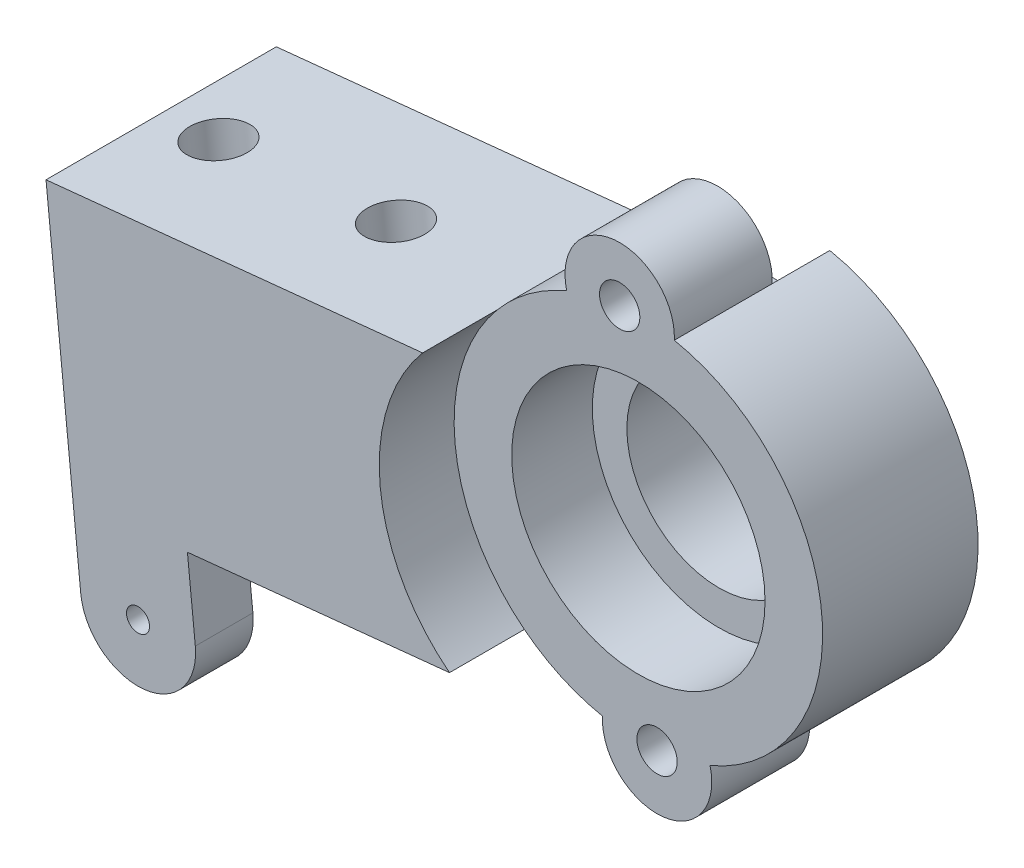
from build123d import *

# Parameters (mm, degrees)
SKETCH1_R                = 16
SKETCH1_R_2              = 11
BOSS_EXTRUDE1_DEPTH      = 7
BOSS_EXTRUDE2_DEPTH      = 10
BOSS_EXTRUDE2_DEPTH_BACK = 10
SKETCH3_W                = 13
SKETCH3_H                = 13
CUT_EXTRUDE1_DEPTH       = 26
BOSS_EXTRUDE5_START      = 6.5
SKETCH8_R                = 16
SKETCH8_R_2              = 8
BOSS_EXTRUDE5_DEPTH      = 6.5
SKETCH9_R                = 1
BOSS_EXTRUDE6_DEPTH      = 20
CUT_EXTRUDE3_DEPTH       = 5
CUT_EXTRUDE3_DEPTH_BACK  = 5
BOSS_EXTRUDE7_START      = -8.5
BOSS_EXTRUDE7_DEPTH      = 8.5
CUT_EXTRUDE4_START       = -13.5
SKETCH12_R               = 1.75
CUT_EXTRUDE4_DEPTH       = 13.5
SKETCH13_R               = 4.75
CUT_EXTRUDE5_DEPTH       = 5
CUT_EXTRUDE6_REACH       = 59.783
SKETCH14_R               = 2.5


with BuildPart() as part:
    # Sketch1 → Boss-Extrude1 (new body)
    with BuildSketch(Plane.XY):
        Circle(SKETCH1_R)
        Circle(SKETCH1_R_2, mode=Mode.SUBTRACT)
    extrude(amount=BOSS_EXTRUDE1_DEPTH)

    # Sketch2 → Boss-Extrude2 (add, two sides: drawn at the far end of the back side and taken through both)
    with BuildSketch(Plane.XY.offset(3.5).offset(-BOSS_EXTRUDE2_DEPTH_BACK)):
        with BuildLine():
            Line((-12.233132214, 10.312636725), (-44.939361172, 6.978812037))
            Line((-44.939361172, 6.978812037), (-42.607001327, -15.902623617))
            Line((-42.607001327, -15.902623617), (-9.900772369, -12.568798928))
            ThreePointArc((-9.900772369, -12.568798928), (-15.917520454, -1.622511196), (-12.233132214, 10.312636725))
        make_face()
    extrude(amount=BOSS_EXTRUDE2_DEPTH + BOSS_EXTRUDE2_DEPTH_BACK)

    # Sketch3 → Cut-Extrude1 (cut)
    with BuildSketch(Plane(origin=(-43.77318125, -4.46190579, 0), x_dir=(0, 0, 1), z_dir=(-0.9948450284027645, -0.10140694977319323, 0))):
        with Locations((3.5, 0)):
            Rectangle(SKETCH3_W, SKETCH3_H)
    extrude(amount=-CUT_EXTRUDE1_DEPTH, mode=Mode.SUBTRACT)

    # Sketch8 → Boss-Extrude5 (add)
    with BuildSketch(Plane(origin=(0, 0, 0), x_dir=(-1, 0, 0), z_dir=(0, 0, -1)).offset(BOSS_EXTRUDE5_START)):
        Circle(SKETCH8_R)
        with Locations(Location((0, 0, 0), (0, 0, 180))):
            Circle(SKETCH8_R_2, mode=Mode.SUBTRACT)
    extrude(amount=-BOSS_EXTRUDE5_DEPTH)

    # Sketch9 → Boss-Extrude6 (add)
    with BuildSketch(Plane(origin=(0, 0, -6.5), x_dir=(-1, 0, 0), z_dir=(0, 0, -1))):
        with BuildLine():
            Line((42.607001327, -15.902623617), (32.658551043, -14.888554119))
            Line((32.658551043, -14.888554119), (31.973720208, -21.607033999))
            ThreePointArc((31.973720208, -21.607033999), (36.440910601, -27.08829389), (41.922170492, -22.621103497))
            Line((41.922170492, -22.621103497), (42.607001327, -15.902623617))
        make_face()
        with Locations((36.94794535, -22.114068748)):
            Circle(SKETCH9_R, mode=Mode.SUBTRACT)
    extrude(amount=-BOSS_EXTRUDE6_DEPTH)

    # Sketch10 → Cut-Extrude3 (cut, two sides: drawn at the far end of the back side and taken through both)
    with BuildSketch(Plane.XY.offset(3.5).offset(-CUT_EXTRUDE3_DEPTH_BACK)):
        with BuildLine():
            Line((-32.658551043, -14.888554119), (-42.607001327, -15.902623617))
            Line((-42.607001327, -15.902623617), (-41.922170492, -22.621103497))
            ThreePointArc((-41.922170492, -22.621103497), (-36.440910601, -27.08829389), (-31.973720208, -21.607033999))
            Line((-31.973720208, -21.607033999), (-32.658551043, -14.888554119))
        make_face()
    extrude(amount=CUT_EXTRUDE3_DEPTH + CUT_EXTRUDE3_DEPTH_BACK, mode=Mode.SUBTRACT)

    # Sketch11 → Boss-Extrude7 (add)
    with BuildSketch(Plane.XY.offset(7).offset(BOSS_EXTRUDE7_START)):
        with BuildLine():
            ThreePointArc((6.224175029, -14.739730161), (2.104194208, -20.643034339), (-3.12215228, -15.692423813))
            ThreePointArc((-3.12215228, -15.692423813), (1.622511196, -15.917520454), (6.224175029, -14.739730161))
        make_face()
    boss_extrude7 = extrude(amount=BOSS_EXTRUDE7_DEPTH)

    # Sketch12 → Cut-Extrude4 (cut)
    with BuildSketch(Plane.XY.offset(7).offset(CUT_EXTRUDE4_START)):
        with Locations((1.622511196, -15.917520454)):
            Circle(SKETCH12_R)
    cut_extrude4 = extrude(amount=CUT_EXTRUDE4_DEPTH, mode=Mode.SUBTRACT)

    # Mirror1: Boss-Extrude7, Cut-Extrude4 across plane
    add(boss_extrude7.mirror(Plane(origin=(0, 0, 0), x_dir=(0, 0, 1), z_dir=(0.10140694977319331, -0.9948450284027645, 0))))
    add(cut_extrude4.mirror(Plane(origin=(0, 0, 0), x_dir=(0, 0, 1), z_dir=(0.10140694977319331, -0.9948450284027645, 0))), mode=Mode.SUBTRACT)

    # Sketch13 → Cut-Extrude5 (cut)
    with BuildSketch(Plane(origin=(0, 0, -6.5), x_dir=(-1, 0, 0), z_dir=(0, 0, -1))):
        with Locations((-1.622511196, -15.917520454)):
            Circle(SKETCH13_R)
        with Locations((1.622511196, 15.917520454)):
            Circle(SKETCH13_R)
    extrude(amount=-CUT_EXTRUDE5_DEPTH, mode=Mode.SUBTRACT)

    # Cut-Extrude6: up to this face of the body (flat: up to its plane)
    cut_extrude6_end = Plane(part.part.faces().sort_by_distance((-28.586246693, 8.645724381, 3.5))[0])
    # Sketch14 → Cut-Extrude6 (cut, up to the picked face)
    with BuildSketch(Plane(origin=(1.166179922, -11.440717827, 0), x_dir=(0.9948450284027645, 0.1014069497731933, 0), z_dir=(0.1014069497731933, -0.9948450284027645, 0)), mode=Mode.PRIVATE) as cut_extrude6_sk1:
        with Locations((-39, 3.5)):
            Circle(SKETCH14_R)
    cut_extrude6_tool1 = split(extrude(cut_extrude6_sk1.sketch, amount=-CUT_EXTRUDE6_REACH, mode=Mode.PRIVATE), bisect_by=cut_extrude6_end, keep=Keep.BOTH, mode=Mode.PRIVATE)
    # Sketch14 → Cut-Extrude6 (cut, up to the picked face)
    with BuildSketch(Plane(origin=(1.166179922, -11.440717827, 0), x_dir=(0.9948450284027645, 0.1014069497731933, 0), z_dir=(0.1014069497731933, -0.9948450284027645, 0)), mode=Mode.PRIVATE) as cut_extrude6_sk2:
        with Locations((-23.5, 3.5)):
            Circle(SKETCH14_R)
    cut_extrude6_tool2 = split(extrude(cut_extrude6_sk2.sketch, amount=-CUT_EXTRUDE6_REACH, mode=Mode.PRIVATE), bisect_by=cut_extrude6_end, keep=Keep.BOTH, mode=Mode.PRIVATE)
    add(cut_extrude6_tool1.solids().sort_by(Axis((-37.632776, -15.395589, 3.5), (-0.1014069497731933, 0.9948450284027645, 0)))[0], mode=Mode.SUBTRACT)
    add(cut_extrude6_tool2.solids().sort_by(Axis((-22.212678, -13.823781, 3.5), (-0.1014069497731933, 0.9948450284027645, 0)))[0], mode=Mode.SUBTRACT)


solid = part.part
